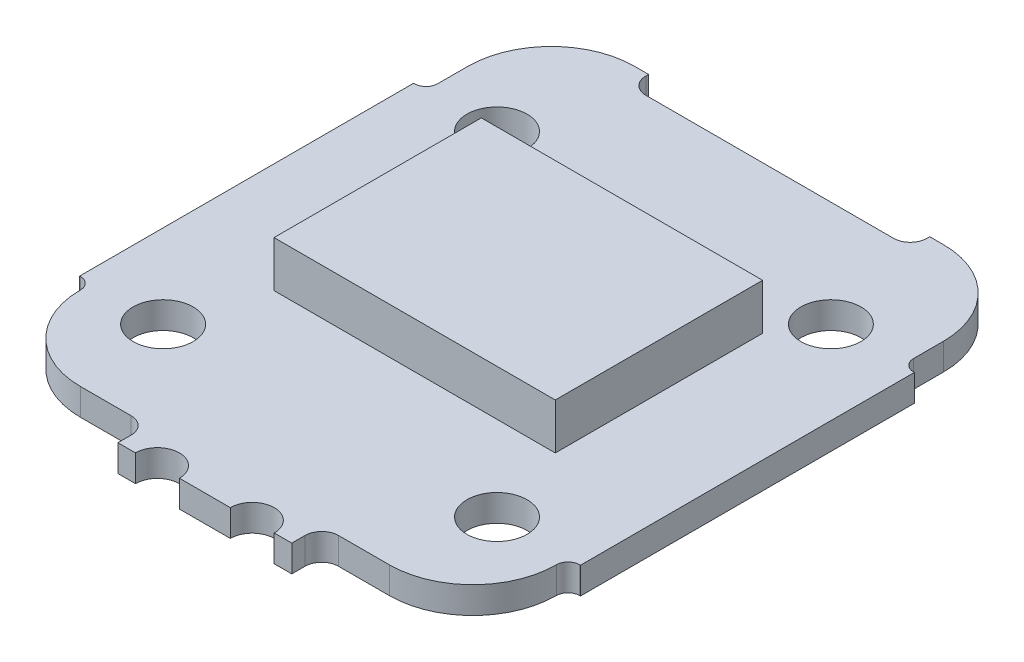
from build123d import *

# Parameters (mm, degrees)
SKETCH1_R           = 1800
BOSS_EXTRUDE1_DEPTH = 1600
SCALE1_SCALE        = 0.001
SKETCH2_W           = 16.847552216
SKETCH2_H           = 12.419052776
BOSS_EXTRUDE2_DEPTH = 2.75


with BuildPart() as part:
    # Sketch1 → Boss-Extrude1 (new body)
    with BuildSketch(Plane(origin=(0, 0, 0), x_dir=(1, 0, 0), z_dir=(0, 1, 0))):
        with BuildLine():
            Line((5206.912757967, -17500), (4155.788895153, -17500))
            ThreePointArc((4155.788895153, -17500), (2840.267529192, -16184.478634039), (1524.746163231, -17500))
            Line((1524.746163231, -17500), (-1524.746163231, -17500))
            ThreePointArc((-1524.746163231, -17500), (-2840.267529192, -16184.478634039), (-4155.788895153, -17500))
            Line((-4155.788895153, -17500), (-5206.912757967, -17500))
            Line((-5206.912757967, -17500), (-5206.912757967, -16704.41462639))
            ThreePointArc((-5206.912757967, -16704.41462639), (-5499.80597678, -15997.307845203), (-6206.912757967, -15704.41462639))
            Line((-6206.912757967, -15704.41462639), (-9252.786387289, -15704.41462639))
            ThreePointArc((-9252.786387289, -15704.41462639), (-12788.320293222, -14239.948532322), (-14252.786387289, -10704.414626389))
            Line((-14252.786387289, -10704.414626389), (-14252.786387289, -10700))
            ThreePointArc((-14252.786387289, -10700), (-14457.811640459, -10205.025253169), (-14952.786387289, -10000))
            Line((-14952.786387289, -10000), (-15000, -10000))
            Line((-15000, -10000), (-15000, 10000))
            Line((-15000, 10000), (-14952.786387289, 10000))
            ThreePointArc((-14952.786387289, 10000), (-14457.811640459, 10205.025253169), (-14252.786387289, 10700))
            Line((-14252.786387289, 10700), (-14252.786387289, 12500))
            ThreePointArc((-14252.786387289, 12500), (-12788.320293222, 16035.533905933), (-9252.786387289, 17500))
            Line((-9252.786387289, 17500), (-8419.317674219, 17500))
            Line((-8419.317674219, 17500), (-8419.317674219, 17333.689702781))
            ThreePointArc((-8419.317674219, 17333.689702781), (-8126.424455406, 16626.582921594), (-7419.317674219, 16333.689702781))
            Line((-7419.317674219, 16333.689702781), (7419.317674219, 16333.689702781))
            ThreePointArc((7419.317674219, 16333.689702781), (8126.424455406, 16626.582921594), (8419.31767422, 17333.689702781))
            Line((8419.31767422, 17333.689702781), (8419.31767422, 17500))
            Line((8419.31767422, 17500), (9252.786387289, 17500))
            ThreePointArc((9252.786387289, 17500), (12788.320293222, 16035.533905933), (14252.786387289, 12500))
            Line((14252.786387289, 12500), (14252.786387289, 10700))
            ThreePointArc((14252.786387289, 10700), (14457.811640459, 10205.02525317), (14952.786387289, 10000))
            Line((14952.786387289, 10000), (15000, 10000))
            Line((15000, 10000), (15000, -10000))
            Line((15000, -10000), (14952.786387289, -10000))
            ThreePointArc((14952.786387289, -10000), (14457.811640459, -10205.02525317), (14252.786387289, -10700))
            Line((14252.786387289, -10700), (14252.786387289, -10704.414626389))
            ThreePointArc((14252.786387289, -10704.414626389), (12788.320293222, -14239.948532322), (9252.786387289, -15704.41462639))
            Line((9252.786387289, -15704.41462639), (6206.912757967, -15704.41462639))
            ThreePointArc((6206.912757967, -15704.41462639), (5499.80597678, -15997.307845203), (5206.912757967, -16704.41462639))
            Line((5206.912757967, -16704.41462639), (5206.912757967, -17500))
        make_face()
        with Locations(Location((10000, -10000, 0), (0, 0, 270))):
            Circle(SKETCH1_R, mode=Mode.SUBTRACT)
        with Locations(Location((-10000, -10000, 0), (0, 0, 270))):
            Circle(SKETCH1_R, mode=Mode.SUBTRACT)
        with Locations(Location((-10000, 10000, 0), (0, 0, 270))):
            Circle(SKETCH1_R, mode=Mode.SUBTRACT)
        with Locations(Location((10000, 10000, 0), (0, 0, 270))):
            Circle(SKETCH1_R, mode=Mode.SUBTRACT)
    extrude(amount=BOSS_EXTRUDE1_DEPTH)


with BuildPart() as part_1:
    # Scale1: scaled about (0, 800, -308.21729277)
    add(part.part.scale(SCALE1_SCALE).moved(Location((0, 799.2, -307.909075477))))

    # Sketch2 → Boss-Extrude2 (add, symmetric)
    with BuildSketch(Plane(origin=(0, 800.8, 0), x_dir=(1, 0, 0), z_dir=(0, 1, 0))):
        with Locations((0, 309.184675859)):
            Rectangle(SKETCH2_W, SKETCH2_H)
    extrude(amount=BOSS_EXTRUDE2_DEPTH, both=True)


solid = part_1.part
